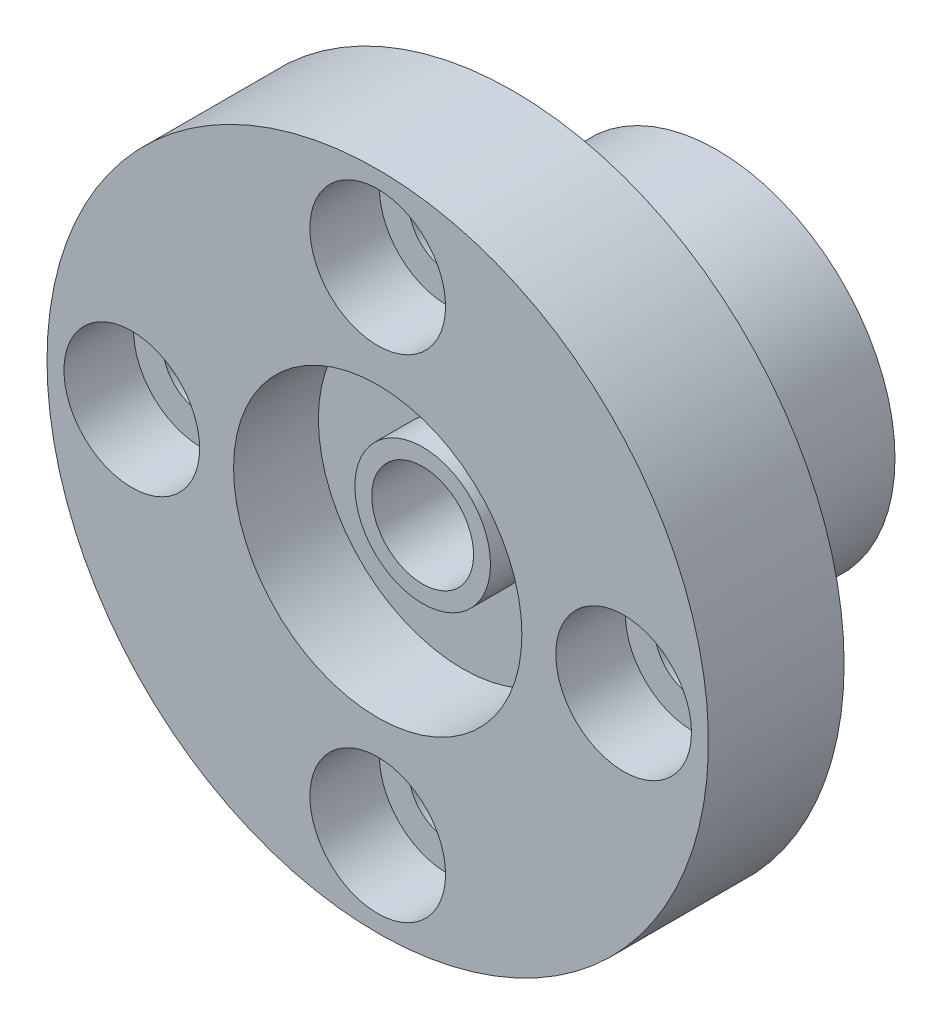
from build123d import *
from build123d.topology import SkipClean

# Parameters (mm, degrees)
SKETCH_1_R           = 19.5
EXTRUDE_1_DEPTH      = 6
SKETCH_2_R           = 9.5
EXTRUDE_2_DEPTH      = 3
SKETCH_3_R           = 5
CUT_EXTRUDE_1_DEPTH  = 50
SKETCH_4_R           = 4
CUT_EXTRUDE_2_DEPTH  = 4.4
SKETCH_5_R           = 2.25
CUT_EXTRUDE_3_DEPTH  = 4.4
SKETCH_6_R           = 2.25
CUT_EXTRUDE_4_DEPTH  = 4.4
SKETCH_7_R           = 2.25
CUT_EXTRUDE_5_DEPTH  = 4.4
SKETCH_8_R           = 10.5
EXTRUDE_3_DEPTH      = 12
SKETCH_9_R           = 8.5
CUT_EXTRUDE_6_DEPTH  = 20
SKETCH_10_R          = 19.5
EXTRUDE_4_DEPTH      = 8
CUT_EXTRUDE_START    = -8
SKETCH_11_R          = 8.5
CUT_EXTRUDE_8_DEPTH  = 8
SKETCH_12_R          = 4
CUT_EXTRUDE_10_DEPTH = 4.1
SKETCH_13_R          = 2.25
CUT_EXTRUDE_11_DEPTH = 4.1
EXTRUDE_START        = -20
SKETCH_14_R          = 8.5
EXTRUDE_5_DEPTH      = 20
SKETCH_15_R          = 8.5
CUT_EXTRUDE_12_DEPTH = 5
SKETCH_17_R          = 4
EXTRUDE_7_DEPTH      = 2.35
SKETCH_18_R          = 3
CUT_EXTRUDE_13_DEPTH = 20
CUT_EXTRUDE_START_2  = -5
SKETCH_19_R          = 8.5
CUT_EXTRUDE_14_DEPTH = 5
EXTRUDE_START_2      = 2.35
SKETCH_20_R          = 4
EXTRUDE_8_DEPTH      = 2.35
CUT_EXTRUDE_START_3  = -2.35
SKETCH_21_R          = 3
CUT_EXTRUDE_15_DEPTH = 2.35


with BuildPart() as part:
    # 草图1 → 凸台-拉伸1 (new body)
    with BuildSketch(Plane.XY):
        Circle(SKETCH_1_R)
    extrude(amount=EXTRUDE_1_DEPTH)

    # 草图2 → 凸台-拉伸2 (add)
    with BuildSketch(Plane(origin=(0, 0, 0), x_dir=(-1, 0, 0), z_dir=(0, 0, -1))):
        Circle(SKETCH_2_R)
    extrude(amount=EXTRUDE_2_DEPTH)

    # 草图3 → 切除-拉伸1 (cut)
    with BuildSketch(Plane(origin=(0, 0, -3), x_dir=(-1, 0, 0), z_dir=(0, 0, -1))):
        Circle(SKETCH_3_R)
    extrude(amount=-CUT_EXTRUDE_1_DEPTH, mode=Mode.SUBTRACT)

    # 草图4 → 切除-拉伸2 (cut)
    with BuildSketch(Plane.XY.offset(6)):
        with Locations((0, 14.5)):
            Circle(SKETCH_4_R)
        with Locations((14.5, 0)):
            Circle(SKETCH_4_R)
        with Locations((0, -14.5)):
            Circle(SKETCH_4_R)
        with Locations((-14.5, 0)):
            Circle(SKETCH_4_R)
    extrude(amount=-CUT_EXTRUDE_2_DEPTH, mode=Mode.SUBTRACT)

    # 草图5 → 切除-拉伸3 (cut)
    with BuildSketch(Plane.XY.offset(1.6)):
        with Locations((-14.5, 0)):
            Circle(SKETCH_5_R)
    extrude(amount=-CUT_EXTRUDE_3_DEPTH, mode=Mode.SUBTRACT)

    # 草图6 → 切除-拉伸4 (cut)
    with BuildSketch(Plane.XY.offset(1.6)):
        with Locations((0, 14.5)):
            Circle(SKETCH_6_R)
    extrude(amount=-CUT_EXTRUDE_4_DEPTH, mode=Mode.SUBTRACT)

    # 草图7 → 切除-拉伸5 (cut)
    with BuildSketch(Plane.XY.offset(1.6)):
        with Locations((14.5, 0)):
            Circle(SKETCH_7_R)
        with Locations((0, -14.5)):
            Circle(SKETCH_7_R)
    extrude(amount=-CUT_EXTRUDE_5_DEPTH, mode=Mode.SUBTRACT)

    # 草图8 → 凸台-拉伸3 (add)
    with BuildSketch(Plane(origin=(0, 0, 0), x_dir=(-1, 0, 0), z_dir=(0, 0, -1))):
        with Locations(Location((0, 0, 0), (0, 0, 180))):
            Circle(SKETCH_8_R)
    extrude(amount=EXTRUDE_3_DEPTH)

    # 草图9 → 切除-拉伸6 (cut)
    with BuildSketch(Plane(origin=(0, 0, -12), x_dir=(-1, 0, 0), z_dir=(0, 0, -1))):
        Circle(SKETCH_9_R)
    extrude(amount=-CUT_EXTRUDE_6_DEPTH, mode=Mode.SUBTRACT)

    # 草图10 → 凸台-拉伸4 (add)
    with SkipClean():  # the faces are left unmerged after this step: merging them gives an invalid solid
        with BuildSketch(Plane(origin=(0, 0, 0), x_dir=(-1, 0, 0), z_dir=(0, 0, -1))):
            Circle(SKETCH_10_R)
        extrude(amount=-EXTRUDE_4_DEPTH)

    # 草图11 → 切除-拉伸8 (cut)
    with SkipClean():  # the faces are left unmerged after this step: merging them gives an invalid solid
        with BuildSketch(Plane.XY.offset(8).offset(CUT_EXTRUDE_START)):
            with Locations(Location((0, 0, 0), (0, 0, 180))):
                Circle(SKETCH_11_R)
        extrude(amount=CUT_EXTRUDE_8_DEPTH, mode=Mode.SUBTRACT)

    # 草图12 → 切除-拉伸10 (cut)
    with SkipClean():  # the faces are left unmerged after this step: merging them gives an invalid solid
        with BuildSketch(Plane.XY.offset(8)):
            with Locations((0, 14.5)):
                Circle(SKETCH_12_R)
            with Locations((14.5, 0)):
                Circle(SKETCH_12_R)
            with Locations((0, -14.5)):
                Circle(SKETCH_12_R)
            with Locations((-14.5, 0)):
                Circle(SKETCH_12_R)
        extrude(amount=-CUT_EXTRUDE_10_DEPTH, mode=Mode.SUBTRACT)

    # 草图13 → 切除-拉伸11 (cut)
    with SkipClean():  # the faces are left unmerged after this step: merging them gives an invalid solid
        with BuildSketch(Plane.XY.offset(3.9)):
            with Locations((0, 14.5)):
                Circle(SKETCH_13_R)
            with Locations((14.5, 0)):
                Circle(SKETCH_13_R)
            with Locations((0, -14.5)):
                Circle(SKETCH_13_R)
            with Locations((-14.5, 0)):
                Circle(SKETCH_13_R)
        extrude(amount=-CUT_EXTRUDE_11_DEPTH, mode=Mode.SUBTRACT)

    # 草图14 → 凸台-拉伸5 (add)
    with SkipClean():  # the faces are left unmerged after this step: merging them gives an invalid solid
        with BuildSketch(Plane.XY.offset(8).offset(EXTRUDE_START)):
            Circle(SKETCH_14_R)
        extrude(amount=EXTRUDE_5_DEPTH)

    # 草图15 → 切除-拉伸12 (cut)
    with SkipClean():  # the faces are left unmerged after this step: merging them gives an invalid solid
        with BuildSketch(Plane(origin=(0, 0, -12), x_dir=(-1, 0, 0), z_dir=(0, 0, -1))):
            Circle(SKETCH_15_R)
        extrude(amount=-CUT_EXTRUDE_12_DEPTH, mode=Mode.SUBTRACT)

    # 草图17 → 凸台-拉伸7 (add)
    with SkipClean():  # the faces are left unmerged after this step: merging them gives an invalid solid
        with BuildSketch(Plane(origin=(0, 0, -7), x_dir=(-1, 0, 0), z_dir=(0, 0, -1))):
            Circle(SKETCH_17_R)
        extrude(amount=EXTRUDE_7_DEPTH)

    # 草图18 → 切除-拉伸13 (cut)
    with SkipClean():  # the faces are left unmerged after this step: merging them gives an invalid solid
        with BuildSketch(Plane(origin=(0, 0, -9.35), x_dir=(-1, 0, 0), z_dir=(0, 0, -1))):
            Circle(SKETCH_18_R)
        extrude(amount=-CUT_EXTRUDE_13_DEPTH, mode=Mode.SUBTRACT)

    # 草图19 → 切除-拉伸14 (cut)
    with SkipClean():  # the faces are left unmerged after this step: merging them gives an invalid solid
        with BuildSketch(Plane.XY.offset(8).offset(CUT_EXTRUDE_START_2)):
            with Locations(Location((0, 0, 0), (0, 0, 180))):
                Circle(SKETCH_19_R)
        extrude(amount=CUT_EXTRUDE_14_DEPTH, mode=Mode.SUBTRACT)

    # 草图20 → 凸台-拉伸8 (add)
    with SkipClean():  # the faces are left unmerged after this step: merging them gives an invalid solid
        with BuildSketch(Plane.XY.offset(3).offset(EXTRUDE_START_2)):
            with Locations(Location((0, 0, 0), (0, 0, 180))):
                Circle(SKETCH_20_R)
        extrude(amount=-EXTRUDE_8_DEPTH)

    # 草图21 → 切除-拉伸15 (cut)
    with SkipClean():  # the faces are left unmerged after this step: merging them gives an invalid solid
        with BuildSketch(Plane.XY.offset(5.35).offset(CUT_EXTRUDE_START_3)):
            with Locations(Location((0, 0, 0), (0, 0, 180))):
                Circle(SKETCH_21_R)
        extrude(amount=CUT_EXTRUDE_15_DEPTH, mode=Mode.SUBTRACT)


solid = part.part
